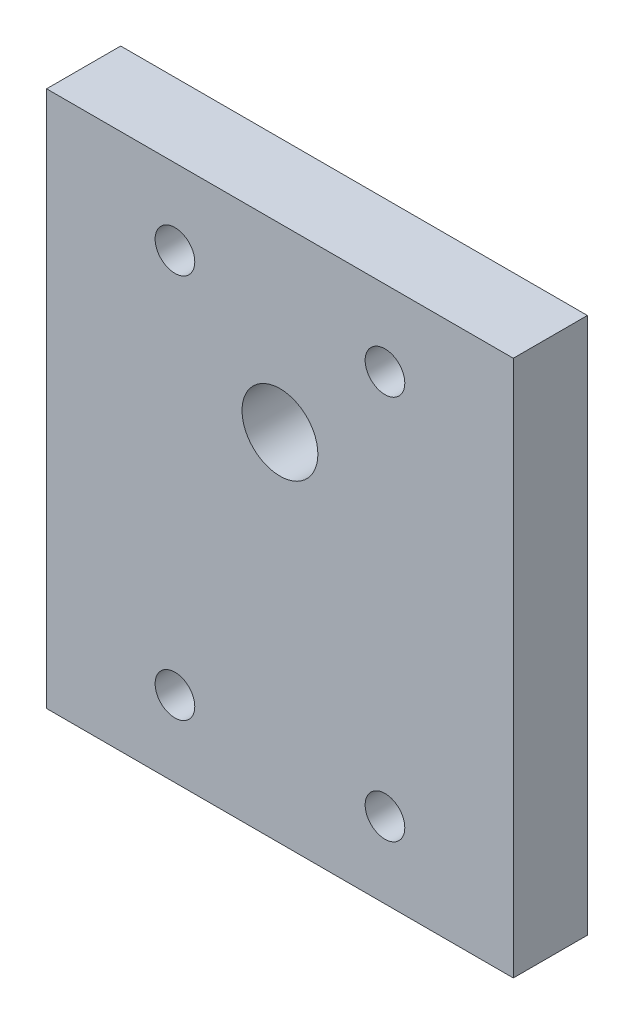
from build123d import *

# Parameters (mm, degrees)
SKETCH1_W           = 40
SKETCH1_H           = 46
SKETCH1_R           = 1.7
SKETCH1_R_2         = 3.25
BOSS_EXTRUDE1_DEPTH = 6.35


with BuildPart() as part:
    # Sketch1 → Boss-Extrude1 (new body)
    with BuildSketch(Plane.XY):
        with Locations((20, 23)):
            Rectangle(SKETCH1_W, SKETCH1_H)
        with Locations((29, 39.5)):
            Circle(SKETCH1_R, mode=Mode.SUBTRACT)
        with Locations((11, 39.5)):
            Circle(SKETCH1_R, mode=Mode.SUBTRACT)
        with Locations((20, 30.5)):
            Circle(SKETCH1_R_2, mode=Mode.SUBTRACT)
        with Locations((11, 6.5)):
            Circle(SKETCH1_R, mode=Mode.SUBTRACT)
        with Locations((29, 6.5)):
            Circle(SKETCH1_R, mode=Mode.SUBTRACT)
    extrude(amount=BOSS_EXTRUDE1_DEPTH)


solid = part.part
